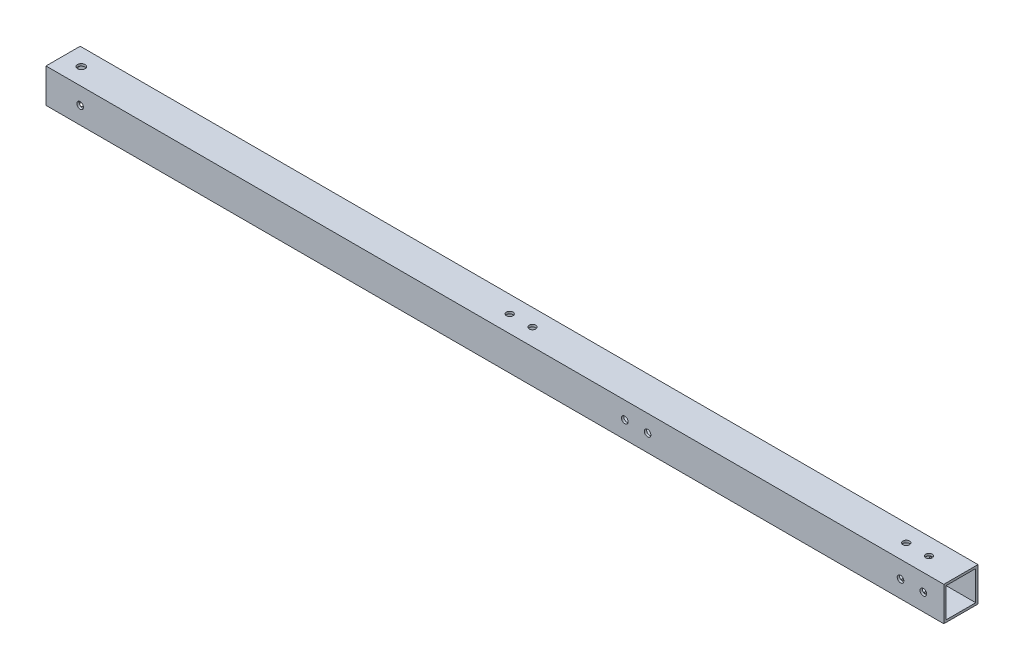
from build123d import *

# Parameters (mm, degrees)
SKETCH_1_W          = 15
SKETCH_1_H          = 15
SKETCH_1_W_2        = 13
SKETCH_1_H_2        = 13
EXTRUDE_1_DEPTH     = 394
SKETCH_2_R          = 1.45
SKETCH_2_R_2        = 1.65
CUT_EXTRUDE_1_DEPTH = 395.356754729
SKETCH_3_R          = 1.45
CUT_EXTRUDE_2_DEPTH = 395.356754729


with BuildPart() as part:
    # 草图1 → 凸台-拉伸1 (new body)
    with BuildSketch(Plane(origin=(0, 0, 0), x_dir=(0, 0, -1), z_dir=(1, 0, 0))):
        Rectangle(SKETCH_1_W, SKETCH_1_H)
        Rectangle(SKETCH_1_W_2, SKETCH_1_H_2, mode=Mode.SUBTRACT)
    extrude(amount=EXTRUDE_1_DEPTH)

    # 草图2 → 切除-拉伸1 (cut, through all)
    with BuildSketch(Plane(origin=(0, 7.5, 0), x_dir=(1, 0, 0), z_dir=(0, 1, 0))):
        with Locations(Location((380, 0, 0), (0, 0, 270))):
            Circle(SKETCH_2_R)
        with Locations(Location((370, 0, 0), (0, 0, 270))):
            Circle(SKETCH_2_R)
        with Locations(Location((196, 0, 0), (0, 0, 270))):
            Circle(SKETCH_2_R)
        with Locations(Location((206, 0, 0), (0, 0, 270))):
            Circle(SKETCH_2_R)
        with Locations(Location((8, 0, 0), (0, 0, 270))):
            Circle(SKETCH_2_R_2)
    extrude(amount=-CUT_EXTRUDE_1_DEPTH, mode=Mode.SUBTRACT)

    # 草图3 → 切除-拉伸2 (cut, through all)
    with BuildSketch(Plane.XY.offset(7.5)):
        with Locations((375, 0)):
            Circle(SKETCH_3_R)
        with Locations((385, 0)):
            Circle(SKETCH_3_R)
        with Locations((264, 0)):
            Circle(SKETCH_3_R)
        with Locations((254, 0)):
            Circle(SKETCH_3_R)
        with Locations((15, 0)):
            Circle(SKETCH_3_R)
    extrude(amount=-CUT_EXTRUDE_2_DEPTH, mode=Mode.SUBTRACT)


solid = part.part
